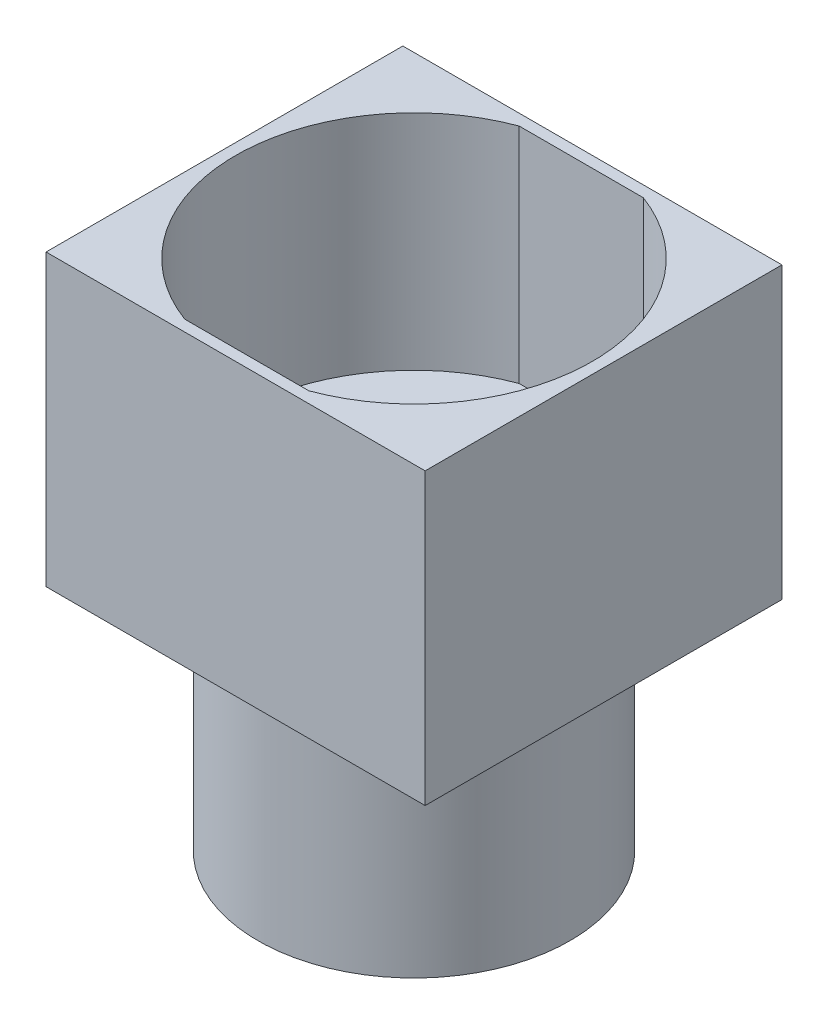
from build123d import *

# Parameters (mm, degrees)
SKETCH1_R           = 7
SKETCH1_R_2         = 4
BOSS_EXTRUDE1_DEPTH = 13
SKETCH5_W           = 17
SKETCH5_H           = 16
BOSS_EXTRUDE3_DEPTH = 3
CUT_EXTRUDE2_START  = -14
SKETCH7_R           = 4
CUT_EXTRUDE2_DEPTH  = 14
SKETCH6_W           = 17
SKETCH6_H           = 16
BOSS_EXTRUDE5_DEPTH = 10


with BuildPart() as part:
    # Sketch1 → Boss-Extrude1 (new body)
    with BuildSketch(Plane(origin=(0, 0, 0), x_dir=(1, 0, 0), z_dir=(0, 1, 0))):
        with Locations(Location((0, 0, 0), (0, 0, 90))):
            Circle(SKETCH1_R)
        with Locations(Location((0, 0, 0), (0, 0, 90))):
            Circle(SKETCH1_R_2, mode=Mode.SUBTRACT)
    extrude(amount=BOSS_EXTRUDE1_DEPTH)

    # Sketch5 → Boss-Extrude3 (add)
    with BuildSketch(Plane(origin=(0, 10, 0), x_dir=(1, 0, 0), z_dir=(0, 1, 0))):
        Rectangle(SKETCH5_W, SKETCH5_H)
    extrude(amount=BOSS_EXTRUDE3_DEPTH)

    # Sketch7 → Cut-Extrude2 (cut)
    with BuildSketch(Plane(origin=(0, 13, 0), x_dir=(1, 0, 0), z_dir=(0, 1, 0)).offset(CUT_EXTRUDE2_START)):
        with Locations(Location((0, 0, 0), (0, 0, 90))):
            Circle(SKETCH7_R)
    extrude(amount=CUT_EXTRUDE2_DEPTH, mode=Mode.SUBTRACT)

    # Sketch6 → Boss-Extrude5 (add)
    with BuildSketch(Plane(origin=(0, 13, 0), x_dir=(1, 0, 0), z_dir=(0, 1, 0))):
        Rectangle(SKETCH6_W, SKETCH6_H)
        with BuildLine():
            ThreePointArc((2.783882181, -7.5), (8, 0), (2.783882181, 7.5))
            Line((2.783882181, 7.5), (-2.783882181, 7.5))
            ThreePointArc((-2.783882181, 7.5), (-8, 0), (-2.783882181, -7.5))
            Line((-2.783882181, -7.5), (2.783882181, -7.5))
        make_face(mode=Mode.SUBTRACT)
    extrude(amount=BOSS_EXTRUDE5_DEPTH)


solid = part.part
